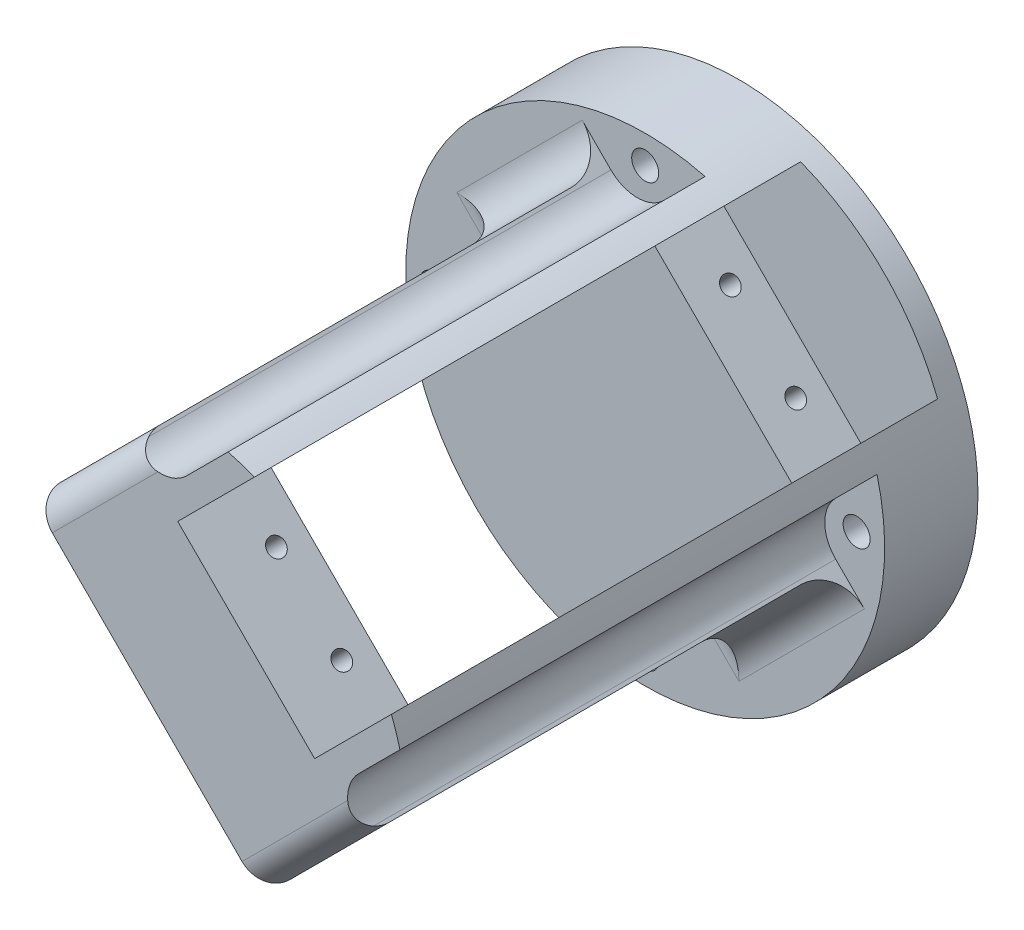
from build123d import *

# Parameters (mm, degrees)
SKETCH1_R               = 25.65
SKETCH1_R_2             = 1.45
BOSS_EXTRUDE1_DEPTH     = 10
CUT_EXTRUDE2_DEPTH      = 38.627715849
CUT_EXTRUDE2_DEPTH_BACK = 7.4
SKETCH3_R               = 0.95
CUT_EXTRUDE3_DEPTH      = 15
BOSS_EXTRUDE2_DEPTH     = 41.11
BOSS_EXTRUDE3_DEPTH     = 10
SKETCH6_R               = 0.95
CUT_EXTRUDE4_DEPTH      = 15
FILLET1_R               = 4
BOSS_EXTRUDE4_DEPTH     = 51.11
FILLET2_R               = 4
FILLET3_R               = 3


with BuildPart() as part:
    # Sketch1 → Boss-Extrude1 (new body)
    with BuildSketch(Plane.XY):
        Circle(SKETCH1_R)
        with Locations((0, -22.65)):
            Circle(SKETCH1_R_2, mode=Mode.SUBTRACT)
        with Locations((22.65, 0)):
            Circle(SKETCH1_R_2, mode=Mode.SUBTRACT)
        with Locations((0, 22.65)):
            Circle(SKETCH1_R_2, mode=Mode.SUBTRACT)
        with Locations((-22.65, 0)):
            Circle(SKETCH1_R_2, mode=Mode.SUBTRACT)
    extrude(amount=BOSS_EXTRUDE1_DEPTH)

    # Sketch2 → Cut-Extrude2 (cut, two sides: drawn at the far end of the back side and taken through both)
    with BuildSketch(Plane.XY.offset(10).offset(-CUT_EXTRUDE2_DEPTH_BACK)):
        Polygon((102.061719716, 116.734185426), (9.251139978, 23.923605688), (1.028840367, 15.701306076), (15.701306076, 1.028840367), (23.923605688, 9.251139978), (116.734185426, 102.061719716), (302.355344902, 287.682879192), (287.682879192, 302.355344902), align=None)
    extrude(amount=CUT_EXTRUDE2_DEPTH + CUT_EXTRUDE2_DEPTH_BACK, mode=Mode.SUBTRACT)

    # Sketch3 → Cut-Extrude3 (cut)
    with BuildSketch(Plane(origin=(8.365073221, 8.365073221, 0), x_dir=(0, 0, -1), z_dir=(0.7071067811865477, 0.7071067811865475, 0))):
        with Locations(Location((-5.74, 4.95, 0), (0, 0, 90))):
            Circle(SKETCH3_R)
        with Locations(Location((-5.74, -4.95, 0), (0, 0, 270))):
            Circle(SKETCH3_R)
    extrude(amount=-CUT_EXTRUDE3_DEPTH, mode=Mode.SUBTRACT)

    # Sketch4 → Boss-Extrude2 (add)
    with BuildSketch(Plane.XY.offset(10)):
        Polygon((-3.920907102, 20.651053545), (1.028840367, 15.701306076), (-9.577761351, 5.094704358), (-14.527508819, 10.044451827), align=None)
        Polygon((15.701306076, 1.028840367), (5.094704358, -9.577761351), (10.044451827, -14.527508819), (20.651053545, -3.920907102), align=None)
    extrude(amount=BOSS_EXTRUDE2_DEPTH)

    # Sketch5 → Boss-Extrude3 (add)
    with BuildSketch(Plane.XY.offset(51.11)):
        Polygon((-3.920907102, 20.651053545), (-14.527508819, 10.044451827), (10.044451827, -14.527508819), (20.651053545, -3.920907102), align=None)
    extrude(amount=BOSS_EXTRUDE3_DEPTH)

    # Sketch6 → Cut-Extrude4 (cut)
    with BuildSketch(Plane(origin=(8.365073221, 8.365073221, 0), x_dir=(0, 0, -1), z_dir=(0.7071067811865471, 0.707106781186548, 0))):
        with Locations(Location((-5.74, -4.95, 0), (0, 0, 270))):
            Circle(SKETCH6_R)
        with Locations(Location((-5.74, 4.95, 0), (0, 0, 90))):
            Circle(SKETCH6_R)
        with Locations(Location((-54.37, -4.95, 0), (0, 0, 270))):
            Circle(SKETCH6_R)
        with Locations(Location((-54.37, 4.95, 0), (0, 0, 270))):
            Circle(SKETCH6_R)
    extrude(amount=-CUT_EXTRUDE4_DEPTH, mode=Mode.SUBTRACT)

    # Fillet1
    fillet1_edges = [part.edges().sort_by_distance(p)[0] for p in [
        (-9.224207961, 15.347752686, 10),
        (-12.052635085, 7.569578093, 10),
        (7.569578093, -12.052635085, 10),
        (15.347752686, -9.224207961, 10),
    ]]
    fillet(fillet1_edges, radius=FILLET1_R)

    # Sketch7 → Boss-Extrude4 (add)
    with BuildSketch(Plane.XY.offset(10)):
        with BuildLine():
            Line((6.41546388, 24.834740248), (-0.844564963, 17.574711406))
            Line((-0.844564963, 17.574711406), (1.028840367, 15.701306076))
            Line((1.028840367, 15.701306076), (9.251139978, 23.923605688))
            ThreePointArc((9.251139978, 23.923605688), (7.846538132, 24.420367306), (6.41546388, 24.834740248))
        make_face()
        with BuildLine():
            Line((17.574711406, -0.844564963), (24.834740248, 6.41546388))
            ThreePointArc((24.834740248, 6.41546388), (24.420367306, 7.846538132), (23.923605688, 9.251139978))
            Line((23.923605688, 9.251139978), (15.701306076, 1.028840367))
            Line((15.701306076, 1.028840367), (17.574711406, -0.844564963))
        make_face()
    extrude(amount=BOSS_EXTRUDE4_DEPTH)

    # Fillet2
    fillet2_edges = [part.edges().sort_by_distance(p)[0] for p in [
        (-0.844564963, 17.574711406, 35.555),
        (17.574711406, -0.844564963, 35.555),
    ]]
    fillet(fillet2_edges, radius=FILLET2_R)

    # Fillet3
    fillet3_edges = [part.edges().sort_by_distance(p)[0] for p in [
        (-9.224207961, 15.347752686, 61.11),
        (15.347752686, -9.224207961, 61.11),
    ]]
    fillet(fillet3_edges, radius=FILLET3_R)


solid = part.part
